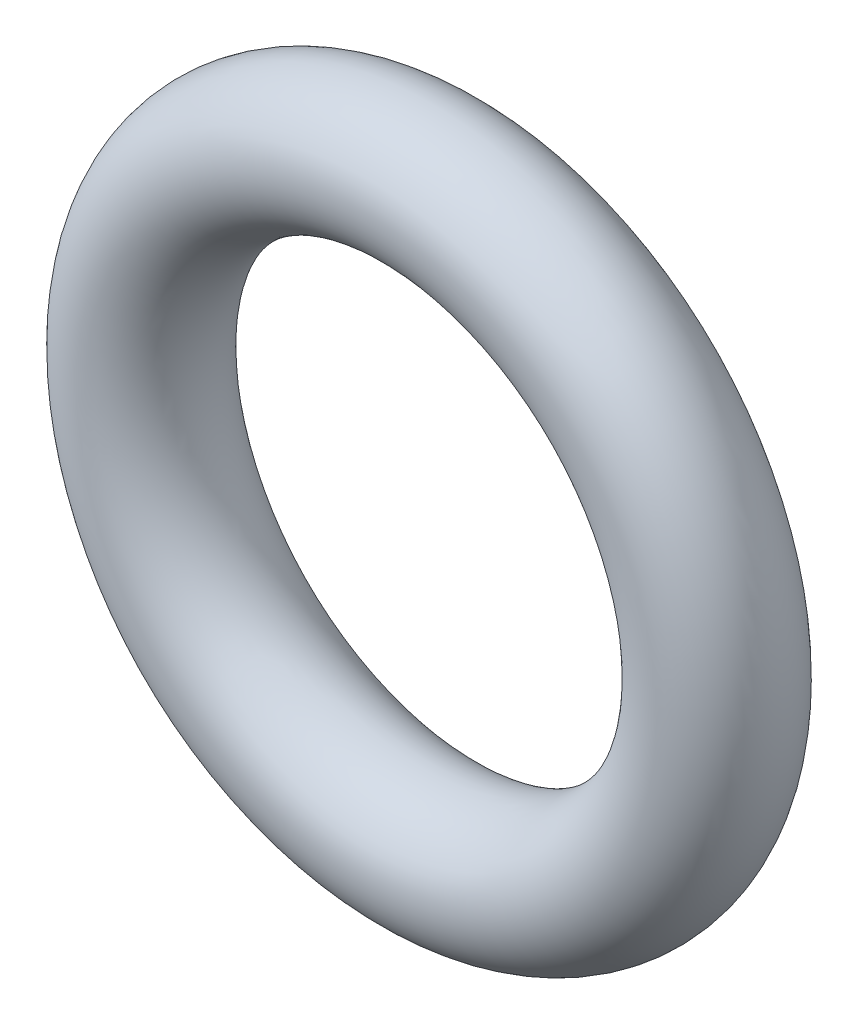
from build123d import *

# Parameters (mm, degrees)
O_RING_SKETCH_R = 0.5


with BuildPart() as part:
    # O-Ring Sketch → O-Ring Revolve (revolve)
    with BuildSketch(Plane(origin=(0, 0, 0), x_dir=(1, 0, 0), z_dir=(0, 1, 0))):
        with Locations((2.15, 0)):
            Circle(O_RING_SKETCH_R)
    revolve(axis=Axis((0, 0, 0), (0, 0, -1)))


solid = part.part
